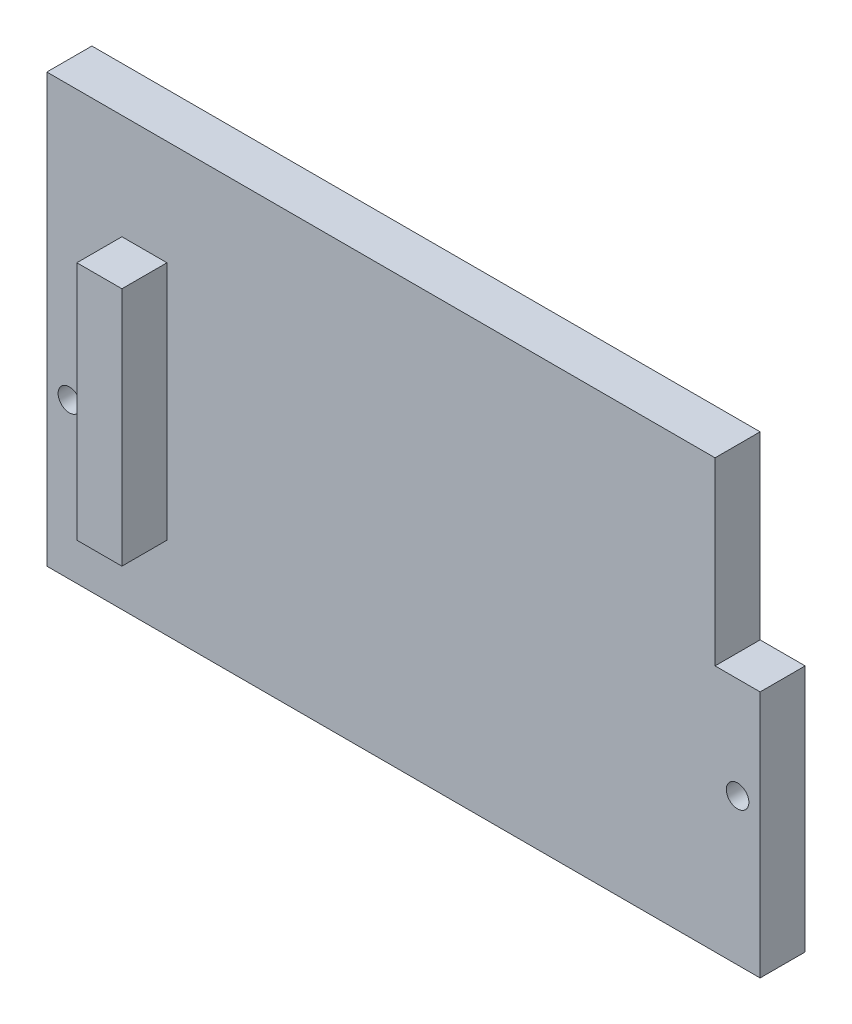
from build123d import *

# Parameters (mm, degrees)
SKETCH1_R           = 1.5
BOSS_EXTRUDE2_DEPTH = 6
SKETCH3_W           = 6
SKETCH3_H           = 32
BOSS_EXTRUDE3_DEPTH = 6


with BuildPart() as part:
    # Sketch1 → Boss-Extrude2 (new body)
    with BuildSketch(Plane.XY):
        Polygon((-47.5, -28.5), (47.5, -28.5), (47.5, 4.5), (41.5, 4.5), (41.5, 28.5), (-47.5, 28.5), align=None)
        with Locations((44.5, -9)):
            Circle(SKETCH1_R, mode=Mode.SUBTRACT)
        with Locations((-44.5, -7.812839041)):
            Circle(SKETCH1_R, mode=Mode.SUBTRACT)
    extrude(amount=BOSS_EXTRUDE2_DEPTH)

    # Sketch3 → Boss-Extrude3 (add)
    with BuildSketch(Plane.XY.offset(6)):
        with Locations((-34.5, -1.5)):
            Rectangle(SKETCH3_W, SKETCH3_H)
    extrude(amount=BOSS_EXTRUDE3_DEPTH)


solid = part.part
